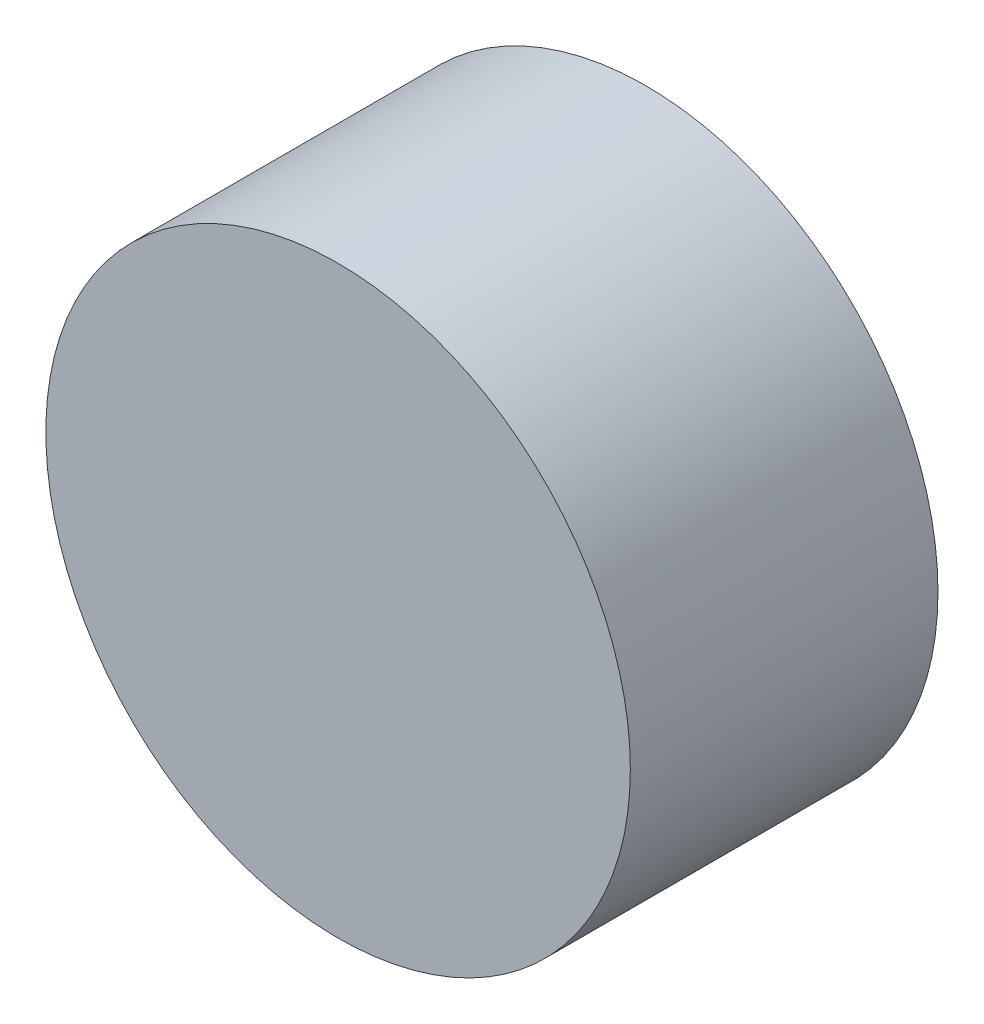
from build123d import *

# Parameters (mm, degrees)
SKETCH1_R           = 57
BOSS_EXTRUDE1_DEPTH = 60


with BuildPart() as part:
    # Sketch1 → Boss-Extrude1 (new body)
    with BuildSketch(Plane.XY):
        Circle(SKETCH1_R)
    extrude(amount=BOSS_EXTRUDE1_DEPTH)


solid = part.part
